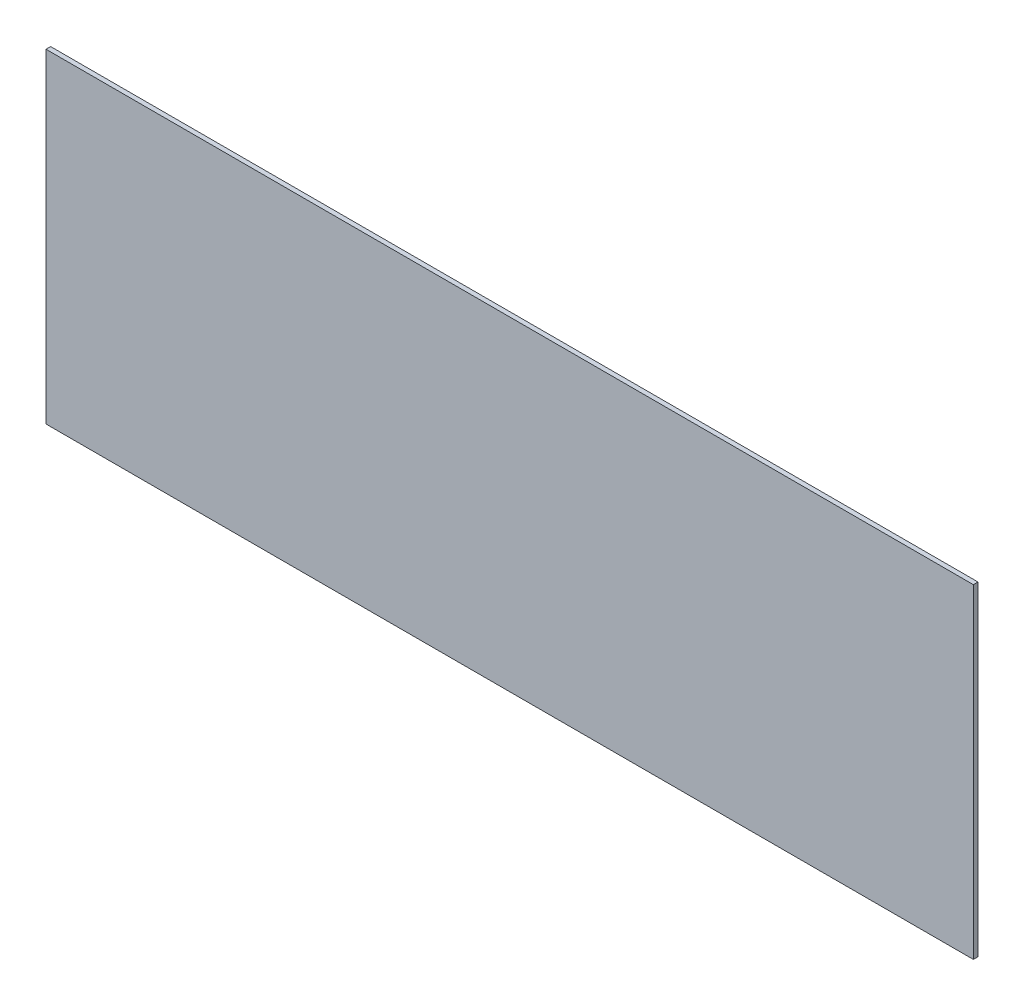
from build123d import *

# Parameters (mm, degrees)
SKETCH1_W           = 200
SKETCH1_H           = 70
BOSS_EXTRUDE1_DEPTH = 1


with BuildPart() as part:
    # Sketch1 → Boss-Extrude1 (new body)
    with BuildSketch(Plane.XY):
        Rectangle(SKETCH1_W, SKETCH1_H)
    extrude(amount=BOSS_EXTRUDE1_DEPTH)


solid = part.part
